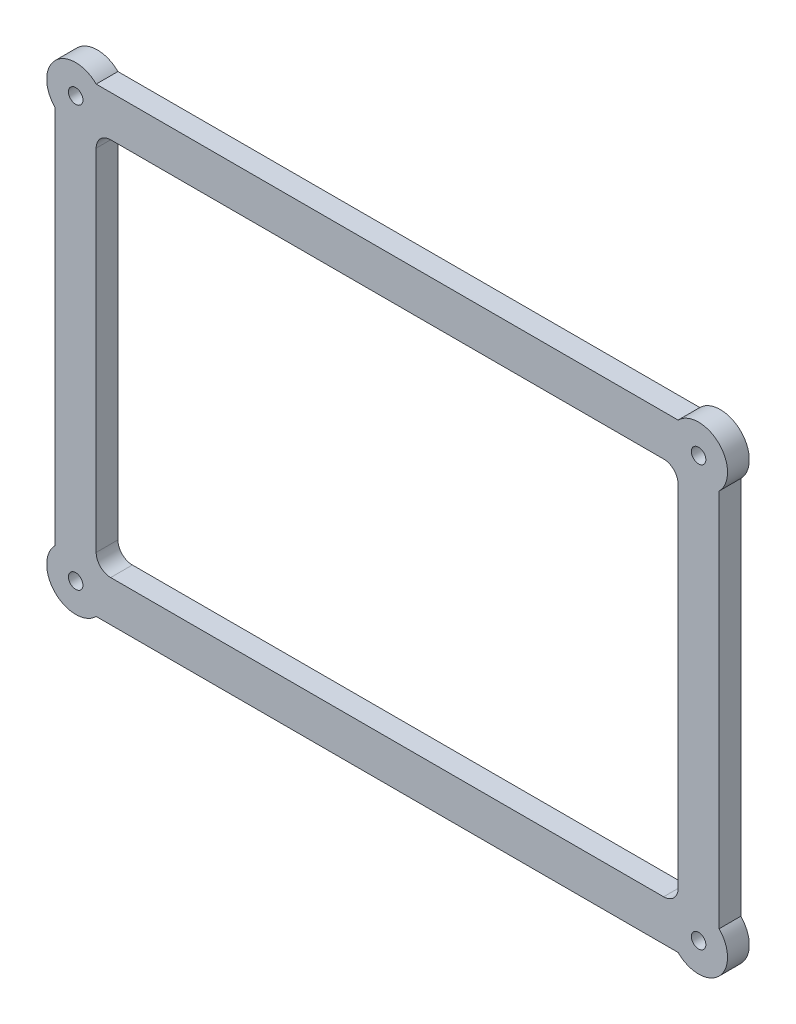
from build123d import *

# Parameters (mm, degrees)
SKETCH_1_R      = 1
SKETCH_1_W      = 80.34314575
SKETCH_1_H      = 52.34314575
EXTRUDE_1_DEPTH = 3
FILLET_1_R      = 2


with BuildPart() as part:
    # 草图1 → 凸台-拉伸1 (new body)
    with BuildSketch(Plane.XY):
        with BuildLine():
            Line((2.828427125, 60.828427125), (83.171572875, 60.828427125))
            ThreePointArc((83.171572875, 60.828427125), (88.828427125, 60.828427125), (88.828427125, 55.171572875))
            Line((88.828427125, 55.171572875), (88.828427125, 2.828427125))
            ThreePointArc((88.828427125, 2.828427125), (88.828427125, -2.828427125), (83.171572875, -2.828427125))
            Line((83.171572875, -2.828427125), (2.828427125, -2.828427125))
            ThreePointArc((2.828427125, -2.828427125), (-2.828427125, -2.828427125), (-2.828427125, 2.828427125))
            Line((-2.828427125, 2.828427125), (-2.828427125, 55.171572875))
            ThreePointArc((-2.828427125, 55.171572875), (-2.828427125, 60.828427125), (2.828427125, 60.828427125))
        make_face()
        with Locations((0, 58)):
            Circle(SKETCH_1_R, mode=Mode.SUBTRACT)
        Circle(SKETCH_1_R, mode=Mode.SUBTRACT)
        with Locations((86, 58)):
            Circle(SKETCH_1_R, mode=Mode.SUBTRACT)
        with Locations((86, 0)):
            Circle(SKETCH_1_R, mode=Mode.SUBTRACT)
        with Locations((43, 29)):
            Rectangle(SKETCH_1_W, SKETCH_1_H, mode=Mode.SUBTRACT)
    extrude(amount=EXTRUDE_1_DEPTH)

    # 圆角1
    fillet_1_edges = [part.edges().sort_by_distance(p)[0] for p in [
        (83.171572875, 2.828427125, 1.5),
        (83.171572875, 55.171572875, 1.5),
        (2.828427125, 55.171572875, 1.5),
        (2.828427125, 2.828427125, 1.5),
    ]]
    fillet(fillet_1_edges, radius=FILLET_1_R)


solid = part.part
